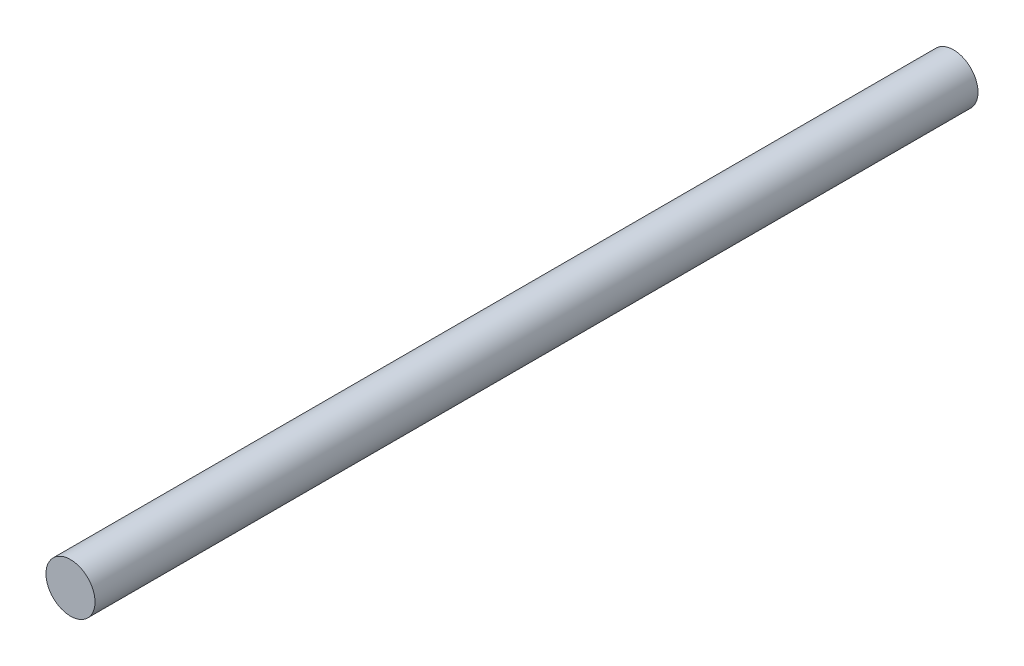
from build123d import *

# Parameters (mm, degrees)
SKETCH1_R           = 3.175
BOSS_EXTRUDE1_DEPTH = 114.3


with BuildPart() as part:
    # Sketch1 → Boss-Extrude1 (new body)
    with BuildSketch(Plane.XY):
        with Locations((-3.158529788, 11.03655816)):
            Circle(SKETCH1_R)
    extrude(amount=BOSS_EXTRUDE1_DEPTH)


solid = part.part
